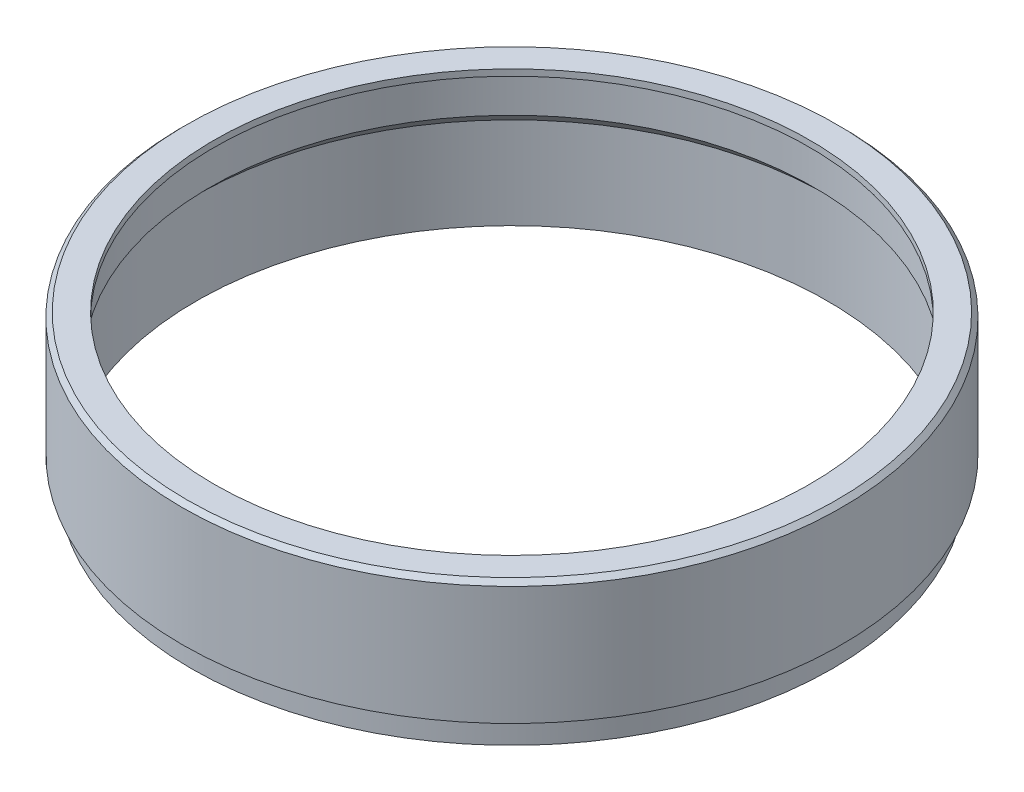
from build123d import *


with BuildPart() as part:
    # Sketch1 → Revolve1 (revolve)
    with BuildSketch(Plane.XY):
        Polygon((-35, 3.2), (-35, 13.35), (-33.5, 14.85), (-33.5, 18.95), (-33, 18.95), (-33, 19.65), (-36, 19.65), (-36.5, 19.15), (-36.5, 6), (-35.5, 6), (-35.5, 3.2), align=None)
    revolve(axis=Axis((0, 0, 0), (0, -1, 0)))


solid = part.part
